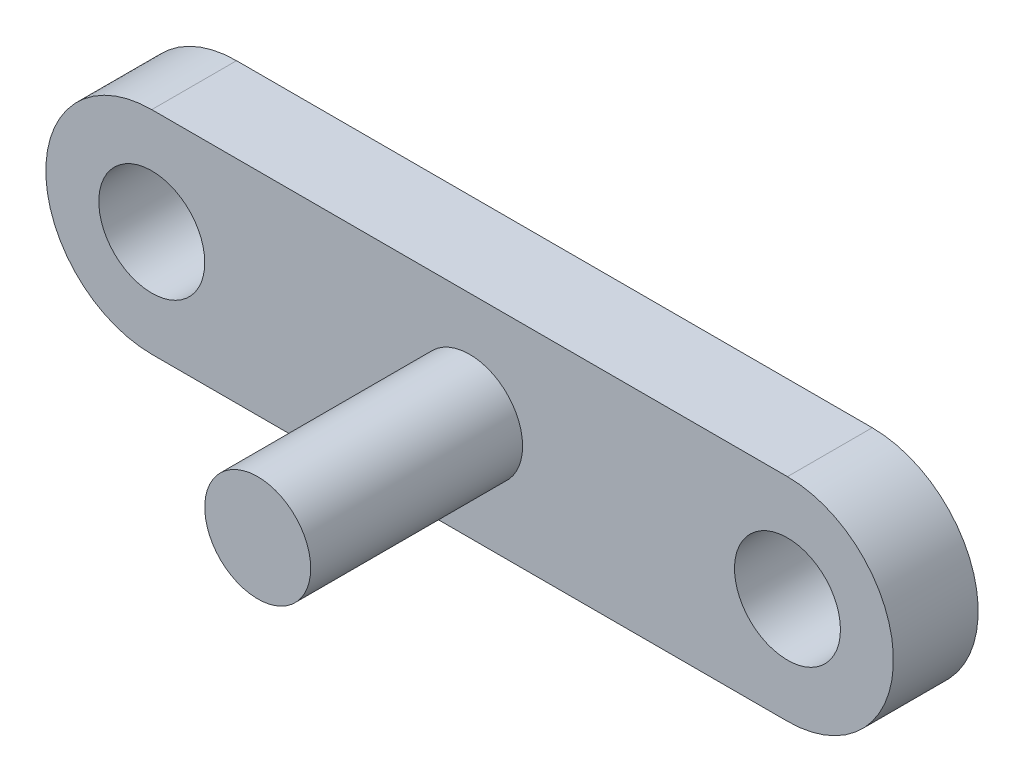
from build123d import *

# Parameters (mm, degrees)
SKETCH1_R           = 2.5
BOSS_EXTRUDE1_DEPTH = 4
SKETCH2_R           = 2.5
BOSS_EXTRUDE2_DEPTH = 10


with BuildPart() as part:
    # Sketch1 → Boss-Extrude1 (new body)
    with BuildSketch(Plane.XY):
        with BuildLine():
            Line((-57.782253853, 15.663533632), (-87.782253853, 15.663533632))
            ThreePointArc((-87.782253853, 15.663533632), (-92.782253853, 10.663533632), (-87.782253853, 5.663533632))
            Line((-87.782253853, 5.663533632), (-57.782253853, 5.663533632))
            ThreePointArc((-57.782253853, 5.663533632), (-52.782253853, 10.663533632), (-57.782253853, 15.663533632))
        make_face()
        with Locations((-57.782253853, 10.663533632)):
            Circle(SKETCH1_R, mode=Mode.SUBTRACT)
        with Locations((-87.782253853, 10.663533632)):
            Circle(SKETCH1_R, mode=Mode.SUBTRACT)
    extrude(amount=BOSS_EXTRUDE1_DEPTH)

    # Sketch2 → Boss-Extrude2 (add)
    with BuildSketch(Plane.XY.offset(4)):
        with Locations((-72.782253853, 10.663533632)):
            Circle(SKETCH2_R)
    extrude(amount=BOSS_EXTRUDE2_DEPTH)


solid = part.part
